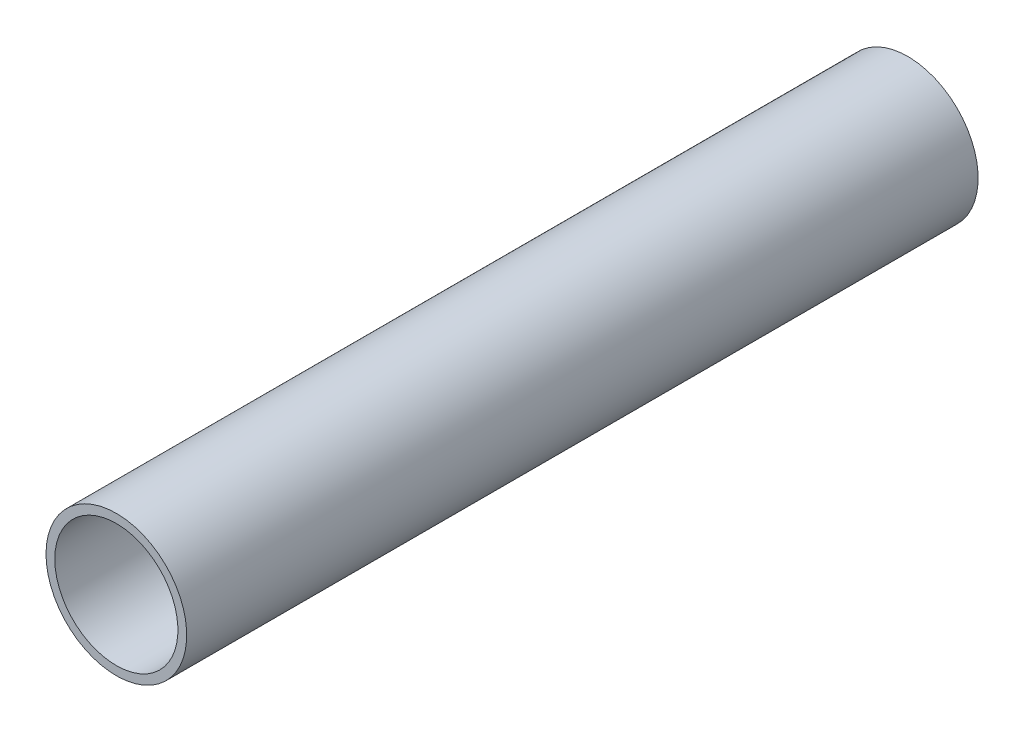
from build123d import *

# Parameters (mm, degrees)
SKETCH_1_R      = 8
SKETCH_1_R_2    = 7
EXTRUDE_1_DEPTH = 90


with BuildPart() as part:
    # 草图1 → 凸台-拉伸1 (new body)
    with BuildSketch(Plane.XY):
        with Locations(Location((0, 0, 0), (0, 0, 180))):
            Circle(SKETCH_1_R)
        with Locations(Location((0, 0, 0), (0, 0, 180))):
            Circle(SKETCH_1_R_2, mode=Mode.SUBTRACT)
    extrude(amount=EXTRUDE_1_DEPTH)


solid = part.part
